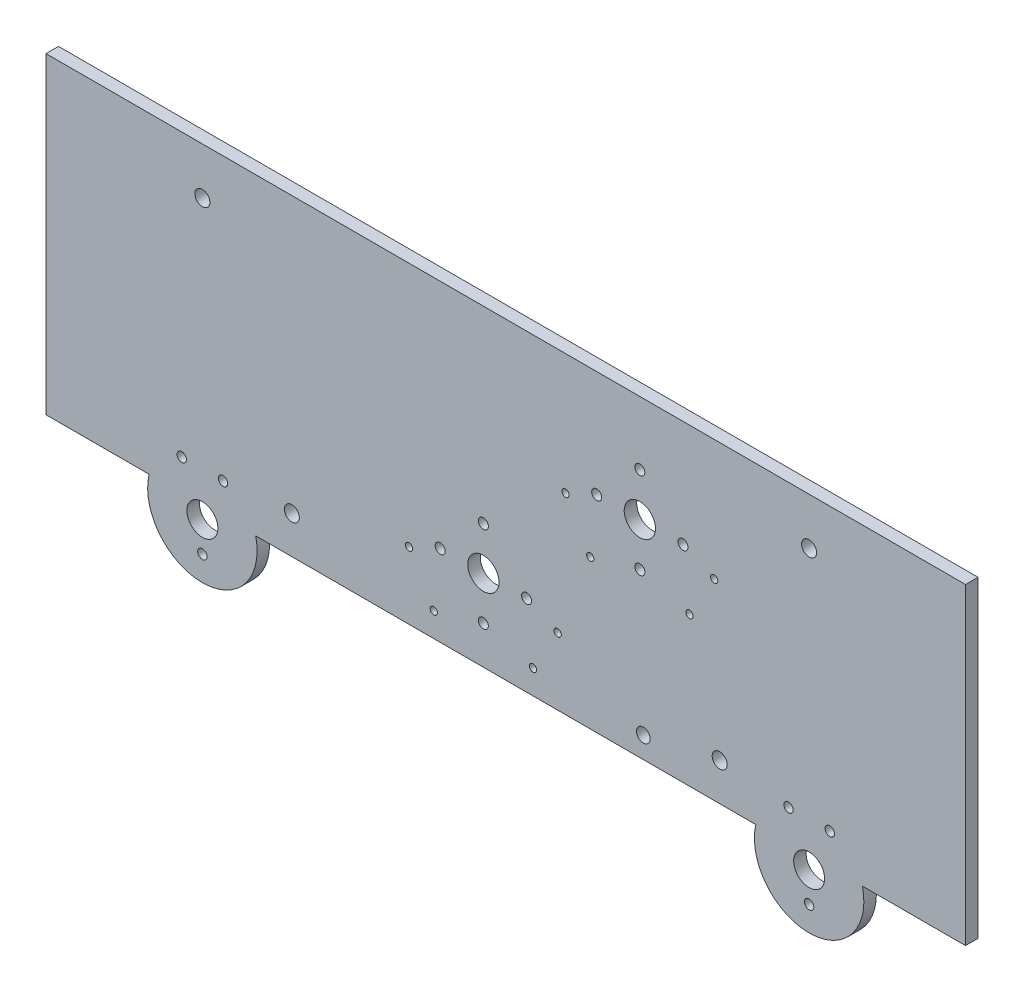
from build123d import *

# Parameters (mm, degrees)
SKETCH2_R           = 3.048
BOSS_EXTRUDE1_DEPTH = 5.07492
SKETCH2_4_R         = 6.2865
CUT_EXTRUDE11_DEPTH = 210.646067011
SKETCH3_R           = 6.35
SKETCH3_R_2         = 2.032
CUT_EXTRUDE12_DEPTH = 210.646067011
SKETCH5_R           = 1.4732
CUT_EXTRUDE13_DEPTH = 210.646067011
SKETCH7_R           = 1.905
CUT_EXTRUDE14_DEPTH = 210.646067011
SKETCH9_R           = 2.794
CUT_EXTRUDE16_DEPTH = 5.08


with BuildPart() as part:
    # Sketch2 → Boss-Extrude1 (new body)
    with BuildSketch(Plane.XY):
        with BuildLine():
            Line((-186.69, -31.75), (-144.826640797, -31.75))
            ThreePointArc((-144.826640797, -31.75), (-123.19, -59.055), (-101.553359203, -31.75))
            Line((-101.553359203, -31.75), (101.553359203, -31.75))
            ThreePointArc((101.553359203, -31.75), (123.19, -59.055), (144.826640797, -31.75))
            Line((144.826640797, -31.75), (186.69, -31.75))
            Line((186.69, -31.75), (186.69, 95.25))
            Line((186.69, 95.25), (-186.69, 95.25))
            Line((-186.69, 95.25), (-186.69, -31.75))
        make_face()
        with Locations((-86.868, -16.51)):
            Circle(SKETCH2_R, mode=Mode.SUBTRACT)
        with Locations((86.868, -16.51)):
            Circle(SKETCH2_R, mode=Mode.SUBTRACT)
        with Locations((123.19, 76.2)):
            Circle(SKETCH2_R, mode=Mode.SUBTRACT)
        with Locations((-123.19, 76.2)):
            Circle(SKETCH2_R, mode=Mode.SUBTRACT)
    extrude(amount=-BOSS_EXTRUDE1_DEPTH)

    # Sketch2<4> → Cut-Extrude11 (cut, through all)
    with BuildSketch(Plane.XY):
        with Locations((-123.19, -36.83)):
            Circle(SKETCH2_4_R)
        with Locations((123.19, -36.83)):
            Circle(SKETCH2_4_R)
    extrude(amount=-CUT_EXTRUDE11_DEPTH, mode=Mode.SUBTRACT)

    # Sketch3 → Cut-Extrude12 (cut, through all)
    with BuildSketch(Plane.XY):
        with Locations((-9.090770625, 1.27)):
            Circle(SKETCH3_R)
        with Locations((54.450542101, 51.954711472)):
            Circle(SKETCH3_R)
        with Locations((-26.616770625, 1.27)):
            Circle(SKETCH3_R_2)
        with Locations((-9.090770625, 18.796)):
            Circle(SKETCH3_R_2)
        with Locations((-9.090770625, -16.256)):
            Circle(SKETCH3_R_2)
        with Locations((8.435229375, 1.27)):
            Circle(SKETCH3_R_2)
        with Locations((36.924542101, 51.954711472)):
            Circle(SKETCH3_R_2)
        with Locations((71.976542101, 51.954711472)):
            Circle(SKETCH3_R_2)
        with Locations((54.450542101, 69.480711472)):
            Circle(SKETCH3_R_2)
        with Locations((54.450542101, 34.428711472)):
            Circle(SKETCH3_R_2)
    extrude(amount=-CUT_EXTRUDE12_DEPTH, mode=Mode.SUBTRACT)

    # Sketch5 → Cut-Extrude13 (cut, through all)
    with BuildSketch(Plane.XY):
        with Locations((-39.274550202, -4.519491037)):
            Circle(SKETCH5_R)
        with Locations((21.093008951, -4.519491037)):
            Circle(SKETCH5_R)
        with Locations((-29.227921948, -21.947964868)):
            Circle(SKETCH5_R)
        with Locations((11.046380698, -21.947964868)):
            Circle(SKETCH5_R)
        with Locations((24.266762524, 46.165220436)):
            Circle(SKETCH5_R)
        with Locations((84.634321678, 46.165220436)):
            Circle(SKETCH5_R)
        with Locations((34.313390778, 28.736746605)):
            Circle(SKETCH5_R)
        with Locations((74.587693424, 28.736746605)):
            Circle(SKETCH5_R)
    extrude(amount=-CUT_EXTRUDE13_DEPTH, mode=Mode.SUBTRACT)

    # Sketch7 → Cut-Extrude14 (cut, through all)
    with BuildSketch(Plane.XY):
        with Locations((131.572, -19.05)):
            Circle(SKETCH7_R)
        with Locations((114.808, -19.05)):
            Circle(SKETCH7_R)
        with Locations((-123.19, -49.022)):
            Circle(SKETCH7_R)
        with Locations((-131.572, -19.05)):
            Circle(SKETCH7_R)
        with Locations((-114.808, -19.05)):
            Circle(SKETCH7_R)
        with Locations((123.19, -49.022)):
            Circle(SKETCH7_R)
    extrude(amount=-CUT_EXTRUDE14_DEPTH, mode=Mode.SUBTRACT)

    # Sketch9 → Cut-Extrude16 (cut)
    with BuildSketch(Plane.XY):
        with Locations((55.88, -23.114)):
            Circle(SKETCH9_R)
    extrude(amount=-CUT_EXTRUDE16_DEPTH, mode=Mode.SUBTRACT)


solid = part.part
